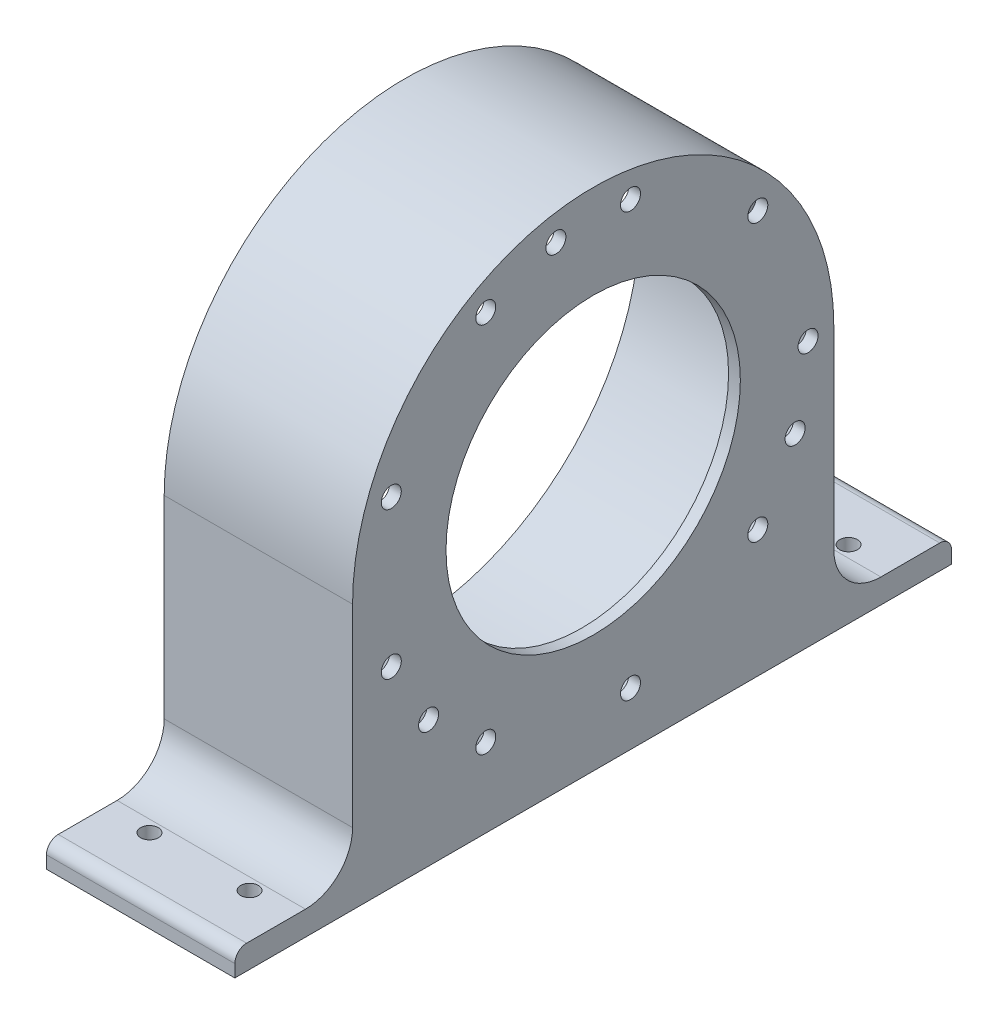
from build123d import *

# Parameters (mm, degrees)
BOSS_EXTRUDE2_DEPTH     = 32
CUT_EXTRUDE1_DEPTH      = 10
CUT_EXTRUDE1_DEPTH_BACK = 40
SKETCH2_R               = 25
CUT_EXTRUDE2_START      = -2
SKETCH3_R               = 39.875
CUT_EXTRUDE2_DEPTH      = 40
FILLET1_R               = 8
FILLET2_R               = 2
CUT_EXTRUDE3_DEPTH      = 10
CUT_EXTRUDE3_DEPTH_BACK = 10
SKETCH5_R               = 1.7
CUT_EXTRUDE4_DEPTH      = 5
CUT_EXTRUDE4_DEPTH_BACK = 7
SKETCH6_R               = 1.5


with BuildPart() as part:
    # Sketch4 → Boss-Extrude2 (new body)
    with BuildSketch(Plane(origin=(0, 0, 0), x_dir=(0, 0, -1), z_dir=(1, 0, 0))):
        with BuildLine():
            Line((-60.875, -40.875), (-60.875, -45))
            Line((-60.875, -45), (60.875, -45))
            Line((60.875, -45), (60.875, -40.875))
            Line((60.875, -40.875), (40.875, -40.875))
            Line((40.875, -40.875), (40.875, 0))
            ThreePointArc((40.875, 0), (0, 40.875), (-40.875, 0))
            Line((-40.875, 0), (-40.875, -40.875))
            Line((-40.875, -40.875), (-60.875, -40.875))
        make_face()
    extrude(amount=-BOSS_EXTRUDE2_DEPTH)

    # Sketch2 → Cut-Extrude1 (cut, two sides: drawn at the far end of the back side and taken through both)
    with BuildSketch(Plane(origin=(0, 0, 0), x_dir=(0, 0, -1), z_dir=(1, 0, 0)).offset(-CUT_EXTRUDE1_DEPTH_BACK)):
        Circle(SKETCH2_R)
    extrude(amount=CUT_EXTRUDE1_DEPTH + CUT_EXTRUDE1_DEPTH_BACK, mode=Mode.SUBTRACT)

    # Sketch3 → Cut-Extrude2 (cut)
    with BuildSketch(Plane(origin=(0, 0, 0), x_dir=(0, 0, -1), z_dir=(1, 0, 0)).offset(CUT_EXTRUDE2_START)):
        Circle(SKETCH3_R)
    extrude(amount=-CUT_EXTRUDE2_DEPTH, mode=Mode.SUBTRACT)

    # Fillet1
    fillet1_edges = [part.edges().sort_by_distance(p)[0] for p in [
        (-16, -40.875, 40.875),
        (-16, -40.875, -40.875),
    ]]
    fillet(fillet1_edges, radius=FILLET1_R)

    # Fillet2
    fillet2_edges = [part.edges().sort_by_distance(p)[0] for p in [
        (-16, -40.875, -60.875),
        (-16, -40.875, 60.875),
    ]]
    fillet(fillet2_edges, radius=FILLET2_R)

    # Sketch5 → Cut-Extrude3 (cut, two sides: drawn at the far end of the back side and taken through both)
    with BuildSketch(Plane(origin=(0, 0, 0), x_dir=(0, 0, -1), z_dir=(1, 0, 0)).offset(-CUT_EXTRUDE3_DEPTH_BACK)):
        with Locations((36.5, 0)):
            Circle(SKETCH5_R)
        with Locations((27.960622174, -23.461747754)):
            Circle(SKETCH5_R)
        with Locations((6.338158485, -35.945482985)):
            Circle(SKETCH5_R)
        with Locations((-18.25, -31.609927238)):
            Circle(SKETCH5_R)
        with Locations((-34.298780659, -12.483735231)):
            Circle(SKETCH5_R)
        with Locations((-34.298780659, 12.483735231)):
            Circle(SKETCH5_R)
        with Locations((-18.25, 31.609927238)):
            Circle(SKETCH5_R)
        with Locations((6.338158485, 35.945482985)):
            Circle(SKETCH5_R)
        with Locations((27.960622174, 23.461747754)):
            Circle(SKETCH5_R)
        with Locations((34.298780659, -12.483735231)):
            Circle(SKETCH5_R)
        with Locations((-27.960622174, -23.461747754)):
            Circle(SKETCH5_R)
        with Locations((-6.338158485, 35.945482985)):
            Circle(SKETCH5_R)
    extrude(amount=CUT_EXTRUDE3_DEPTH + CUT_EXTRUDE3_DEPTH_BACK, mode=Mode.SUBTRACT)

    # Sketch6 → Cut-Extrude4 (cut, two sides: drawn at the far end of the back side and taken through both)
    with BuildSketch(Plane(origin=(0, -45, 0), x_dir=(-1, 0, 0), z_dir=(0, -1, 0)).offset(-CUT_EXTRUDE4_DEPTH_BACK)):
        with Locations((7.5, 50.875)):
            Circle(SKETCH6_R)
        with Locations((24.5, 50.875)):
            Circle(SKETCH6_R)
        with Locations((24.5, -50.875)):
            Circle(SKETCH6_R)
        with Locations((7.5, -50.875)):
            Circle(SKETCH6_R)
    extrude(amount=CUT_EXTRUDE4_DEPTH + CUT_EXTRUDE4_DEPTH_BACK, mode=Mode.SUBTRACT)


solid = part.part
